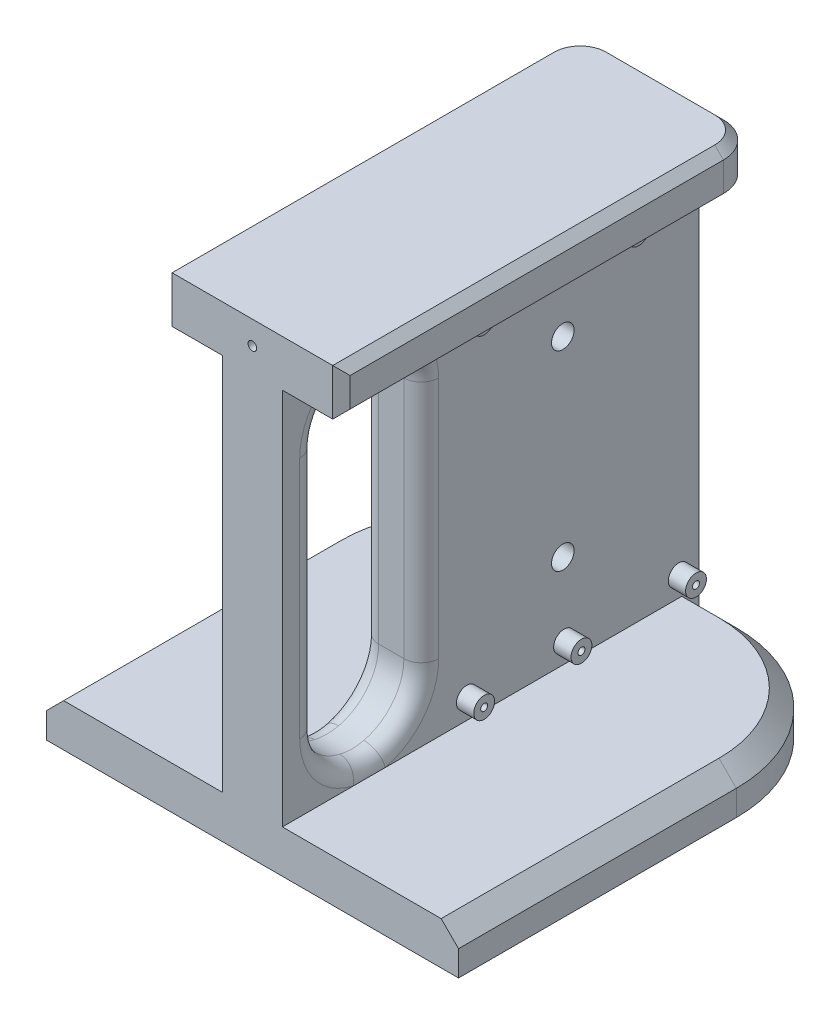
from build123d import *

# Parameters (mm, degrees)
BOSS_EXTRUDE1_DEPTH      = 60
BOSS_EXTRUDE1_DEPTH_BACK = 60
SKETCH2_W                = 17.261807542
SKETCH2_H                = 108.92334372
SKETCH3_R                = 3
SKETCH3_R_2              = 1
BOSS_EXTRUDE2_DEPTH      = 5
SKETCH4_R                = 3.25
CUT_EXTRUDE1_DEPTH       = 21
CUT_EXTRUDE2_DEPTH       = 114.240882246
FILLET1_R                = 40
FILLET3_R                = 5
FILLET4_R                = 10
SKETCH6_R                = 1
CUT_EXTRUDE3_DEPTH       = 7.5
CHAMFER2_SIZE            = 2.5
CHAMFER4_SIZE            = 5
SKETCH7_R                = 1.25
CUT_EXTRUDE4_DEPTH       = 7.5


with BuildPart() as part:
    # Sketch2 → Boss-Extrude1 (new, two sides: drawn at the far end of the back side and taken through both)
    with BuildSketch(Plane.XY.offset(-BOSS_EXTRUDE1_DEPTH_BACK)):
        Polygon((-8.630903771, 54.46167186), (8.630903771, 54.46167186), (25.625086391, 54.46167186), (25.625086391, 67.842918018), (-25.625086391, 67.842918018), (-25.625086391, 54.46167186), align=None)
        Rectangle(SKETCH2_W, SKETCH2_H)
        Polygon((59.345826708, -54.46167186), (8.630903771, -54.46167186), (-8.630903771, -54.46167186), (-59.345826708, -54.46167186), (-59.345826708, -66.772418325), (59.345826708, -66.772418325), align=None)
    extrude(amount=BOSS_EXTRUDE1_DEPTH + BOSS_EXTRUDE1_DEPTH_BACK)

    # Sketch3 → Boss-Extrude2 (add)
    # profile 1 of 6: a face of its own
    with BuildSketch(Plane(origin=(8.630903771, 0, 0), x_dir=(0, 0, -1), z_dir=(1, 0, 0))):
        with Locations(Location((-6.9, 47.168726105, 0), (0, 0, 180))):
            Circle(SKETCH3_R)
        with Locations((-6.9, 47.168726105)):
            Circle(SKETCH3_R_2, mode=Mode.SUBTRACT)
    # profile 2 of 6: a face of its own
    with BuildSketch(Plane(origin=(8.630903771, 0, 0), x_dir=(0, 0, -1), z_dir=(1, 0, 0))):
        with Locations(Location((37.6, 47.168726105, 0), (0, 0, 180))):
            Circle(SKETCH3_R)
        with Locations((37.6, 47.168726105)):
            Circle(SKETCH3_R_2, mode=Mode.SUBTRACT)
    # profile 3 of 6: a face of its own
    with BuildSketch(Plane(origin=(8.630903771, 0, 0), x_dir=(0, 0, -1), z_dir=(1, 0, 0))):
        with Locations(Location((54.1, 48.818726105, 0), (0, 0, 180))):
            Circle(SKETCH3_R)
        with Locations((54.1, 48.818726105)):
            Circle(SKETCH3_R_2, mode=Mode.SUBTRACT)
    # profile 4 of 6: a face of its own
    with BuildSketch(Plane(origin=(8.630903771, 0, 0), x_dir=(0, 0, -1), z_dir=(1, 0, 0))):
        with Locations(Location((54.1, -48.691074046, 0), (0, 0, 180))):
            Circle(SKETCH3_R)
        with Locations((54.1, -48.691074046)):
            Circle(SKETCH3_R_2, mode=Mode.SUBTRACT)
    # profile 5 of 6: a face of its own
    with BuildSketch(Plane(origin=(8.630903771, 0, 0), x_dir=(0, 0, -1), z_dir=(1, 0, 0))):
        with Locations(Location((21.1, -48.691074046, 0), (0, 0, 180))):
            Circle(SKETCH3_R)
        with Locations((21.1, -48.691074046)):
            Circle(SKETCH3_R_2, mode=Mode.SUBTRACT)
    # profile 6 of 6: a face of its own
    with BuildSketch(Plane(origin=(8.630903771, 0, 0), x_dir=(0, 0, -1), z_dir=(1, 0, 0))):
        with Locations(Location((-6.9, -48.691074046, 0), (0, 0, 180))):
            Circle(SKETCH3_R)
        with Locations((-6.9, -48.691074046)):
            Circle(SKETCH3_R_2, mode=Mode.SUBTRACT)
    extrude(amount=BOSS_EXTRUDE2_DEPTH)

    # Sketch4 → Cut-Extrude1 (cut, symmetric)
    with BuildSketch(Plane(origin=(8.630903771, 0, 0), x_dir=(0, 0, -1), z_dir=(1, 0, 0))):
        with Locations((20.75, 27.46167186)):
            Circle(SKETCH4_R)
        with Locations((20.75, -27.53832814)):
            Circle(SKETCH4_R)
    extrude(amount=CUT_EXTRUDE1_DEPTH, both=True, mode=Mode.SUBTRACT)

    # Sketch5 → Cut-Extrude2 (cut, through all)
    with BuildSketch(Plane(origin=(8.630903771, 0, 0), x_dir=(0, 0, -1), z_dir=(1, 0, 0))):
        with BuildLine():
            Line((-20, 35), (-20, -35))
            ThreePointArc((-20, -35), (-35, -50), (-50, -35))
            Line((-50, -35), (-50, 35))
            ThreePointArc((-50, 35), (-35, 50), (-20, 35))
        make_face()
    extrude(amount=-CUT_EXTRUDE2_DEPTH, mode=Mode.SUBTRACT)

    # Fillet1
    fillet1_edges = [part.edges().sort_by_distance(p)[0] for p in [
        (-59.345826708, -60.617045093, -60),
        (59.345826708, -60.617045093, -60),
    ]]
    fillet(fillet1_edges, radius=FILLET1_R)

    # Fillet3
    fillet3_edges = [part.edges().sort_by_distance(p)[0] for p in [
        (-8.630903771, 0, 50),
        (-8.630903771, -50, 35),
        (-8.630903771, 0, 20),
        (-8.630903771, 50, 35),
        (8.630903771, 0, 20),
        (8.630903771, 50, 35),
        (8.630903771, 0, 50),
        (8.630903771, -50, 35),
    ]]
    fillet(fillet3_edges, radius=FILLET3_R)

    # Fillet4
    fillet4_edges = [part.edges().sort_by_distance(p)[0] for p in [
        (-25.625086391, 61.152294939, -60),
        (25.625086391, 61.152294939, -60),
    ]]
    fillet(fillet4_edges, radius=FILLET4_R)

    # Sketch6 → Cut-Extrude3 (cut)
    with BuildSketch(Plane(origin=(0, 0, -60), x_dir=(-1, 0, 0), z_dir=(0, 0, -1))):
        with Locations((11.75, 61.342918018)):
            Circle(SKETCH6_R)
        with Locations((-11.75, 61.342918018)):
            Circle(SKETCH6_R)
    extrude(amount=-CUT_EXTRUDE3_DEPTH, mode=Mode.SUBTRACT)

    # Chamfer2
    chamfer2_edges = [part.edges().sort_by_distance(p)[0] for p in [
        (-12.127995081, 54.46167186, -60),
        (-25.625086391, 54.46167186, 5),
        (-25.625086391, 67.842918018, 5),
        (-22.696154203, 54.46167186, -57.071067812),
        (0, 67.842918018, -60),
        (12.127995081, 54.46167186, -60),
        (25.625086391, 67.842918018, 5),
        (22.696154203, 67.842918018, -57.071067812),
        (-22.696154203, 67.842918018, -57.071067812),
        (25.625086391, 54.46167186, 5),
        (22.696154203, 54.46167186, -57.071067812),
        (25.625086391, 61.152294939, 60),
        (-25.625086391, 61.152294939, 60),
    ]]
    chamfer(chamfer2_edges, length=CHAMFER2_SIZE)

    # Chamfer4
    chamfer4_edges = [part.edges().sort_by_distance(p)[0] for p in [
        (-13.98836524, -54.46167186, -60),
        (-59.345826708, -54.46167186, 20),
        (-47.630097955, -54.46167186, -48.284271247),
        (59.345826708, -54.46167186, 20),
        (47.630097955, -54.46167186, -48.284271247),
        (13.98836524, -54.46167186, -60),
    ]]
    chamfer(chamfer4_edges, length=CHAMFER4_SIZE)

    # Sketch7 → Cut-Extrude4 (cut)
    with BuildSketch(Plane.XY.offset(60)):
        with Locations((0, 61.152294939)):
            Circle(SKETCH7_R)
    extrude(amount=-CUT_EXTRUDE4_DEPTH, mode=Mode.SUBTRACT)


solid = part.part
